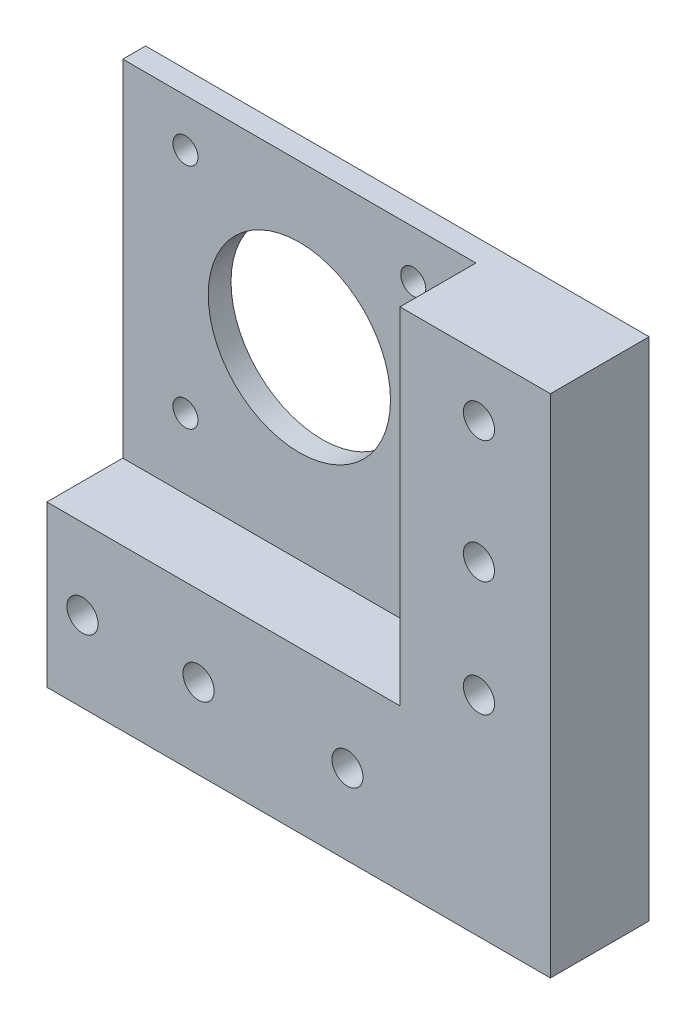
from build123d import *

# Parameters (mm, degrees)
SKETCH1_W                = 46.5
SKETCH1_H                = 40
BOSS_EXTRUDE1_DEPTH      = 3
BOSS_EXTRUDE2_DEPTH      = 42.5
SKETCH4_R                = 12
SKETCH4_R_2              = 1.65
CUT_EXTRUDE2_DEPTH       = 77.37080594
SKETCH7_W                = 19.811299136
SKETCH7_H                = 45.5
SKETCH7_R                = 2.05
SKETCH7_W_2              = 46.5
SKETCH7_H_2              = 21.133566933
SKETCH7_R_2              = 1.65
SKETCH7_R_3              = 12
BOSS_EXTRUDE3_DEPTH      = 3
BOSS_EXTRUDE8_DEPTH      = 10
BOSS_EXTRUDE8_DEPTH_BACK = 3
SKETCH7_6_W              = 19.811299136
SKETCH7_6_H              = 21.133566933
SKETCH7_6_H_2            = 45.5
SKETCH7_6_R              = 2.05
SKETCH7_6_W_2            = 46.5
CUT_EXTRUDE4_DEPTH       = 37


with BuildPart() as part:
    # Sketch1 → Boss-Extrude1 (new body)
    with BuildSketch(Plane(origin=(0, 0, 0), x_dir=(1, 0, 0), z_dir=(0, 1, 0))):
        with Locations((23.25, 20)):
            Rectangle(SKETCH1_W, SKETCH1_H)
    extrude(amount=BOSS_EXTRUDE1_DEPTH)

    # Sketch2 → Boss-Extrude2 (add)
    with BuildSketch(Plane(origin=(0, 3, 0), x_dir=(1, 0, 0), z_dir=(0, 1, 0))):
        Polygon((2, 2.5), (2, 40), (0, 40), (0, 0), (46.5, 0), (46.5, 40), (44.5, 40), (44.5, 2.5), align=None)
    extrude(amount=BOSS_EXTRUDE2_DEPTH)

    # Sketch4 → Cut-Extrude2 (cut, through all)
    with BuildSketch(Plane.XY):
        with Locations((23.25, 24.25)):
            Circle(SKETCH4_R)
        with Locations((8.25, 9.25)):
            Circle(SKETCH4_R_2)
        with Locations((8.25, 39.25)):
            Circle(SKETCH4_R_2)
        with Locations((38.25, 39.25)):
            Circle(SKETCH4_R_2)
        with Locations((38.25, 9.25)):
            Circle(SKETCH4_R_2)
    extrude(amount=-CUT_EXTRUDE2_DEPTH, mode=Mode.SUBTRACT)

    # Sketch7 → Boss-Extrude3 (add)
    # profile 1 of 3: a face of its own
    with BuildSketch(Plane.XY):
        with Locations((56.405649568, 22.75)):
            Rectangle(SKETCH7_W, SKETCH7_H)
        with Locations((56.903073356, 21.609445831)):
            Circle(SKETCH7_R, mode=Mode.SUBTRACT)
        with Locations((56.903073356, 6.429697542)):
            Circle(SKETCH7_R, mode=Mode.SUBTRACT)
        with Locations((56.903073356, 37.721588907)):
            Circle(SKETCH7_R, mode=Mode.SUBTRACT)
    # profile 2 of 3: a face of its own
    with BuildSketch(Plane.XY):
        with Locations((23.25, -10.566783467)):
            Rectangle(SKETCH7_W_2, SKETCH7_H_2)
        with Locations((19.976924994, -10.566783466)):
            Circle(SKETCH7_R, mode=Mode.SUBTRACT)
        with Locations((4.691261717, -10.566783466)):
            Circle(SKETCH7_R, mode=Mode.SUBTRACT)
        with Locations((39.582435854, -10.566783466)):
            Circle(SKETCH7_R, mode=Mode.SUBTRACT)
    # profile 3 of 3: a face of its own
    with BuildSketch(Plane.XY):
        with Locations((23.25, 22.75)):
            Rectangle(SKETCH7_W_2, SKETCH7_H)
        with Locations((8.25, 39.25)):
            Circle(SKETCH7_R_2, mode=Mode.SUBTRACT)
        with Locations((38.25, 9.25)):
            Circle(SKETCH7_R_2, mode=Mode.SUBTRACT)
        with Locations((23.25, 24.25)):
            Circle(SKETCH7_R_3, mode=Mode.SUBTRACT)
        with Locations((38.25, 39.25)):
            Circle(SKETCH7_R_2, mode=Mode.SUBTRACT)
        with Locations((8.25, 9.25)):
            Circle(SKETCH7_R_2, mode=Mode.SUBTRACT)
    extrude(amount=-BOSS_EXTRUDE3_DEPTH)

    # Sketch7<6> → Boss-Extrude8 (add, two sides: drawn at the far end of the back side and taken through both)
    # profile 1 of 3: a face of its own
    with BuildSketch(Plane.XY.offset(-BOSS_EXTRUDE8_DEPTH_BACK)):
        with Locations((56.405649568, -10.566783467)):
            Rectangle(SKETCH7_6_W, SKETCH7_6_H)
    # profile 2 of 3: a face of its own
    with BuildSketch(Plane.XY.offset(-BOSS_EXTRUDE8_DEPTH_BACK)):
        with Locations((56.405649568, 22.75)):
            Rectangle(SKETCH7_6_W, SKETCH7_6_H_2)
        with Locations((56.903073356, 21.609445831)):
            Circle(SKETCH7_6_R, mode=Mode.SUBTRACT)
        with Locations((56.903073356, 6.429697542)):
            Circle(SKETCH7_6_R, mode=Mode.SUBTRACT)
        with Locations((56.903073356, 37.721588907)):
            Circle(SKETCH7_6_R, mode=Mode.SUBTRACT)
    # profile 3 of 3: a face of its own
    with BuildSketch(Plane.XY.offset(-BOSS_EXTRUDE8_DEPTH_BACK)):
        with Locations((23.25, -10.566783467)):
            Rectangle(SKETCH7_6_W_2, SKETCH7_6_H)
        with Locations((19.976924994, -10.566783466)):
            Circle(SKETCH7_6_R, mode=Mode.SUBTRACT)
        with Locations((4.691261717, -10.566783466)):
            Circle(SKETCH7_6_R, mode=Mode.SUBTRACT)
        with Locations((39.582435854, -10.566783466)):
            Circle(SKETCH7_6_R, mode=Mode.SUBTRACT)
    extrude(amount=BOSS_EXTRUDE8_DEPTH + BOSS_EXTRUDE8_DEPTH_BACK)

    # Sketch8 → Cut-Extrude4 (cut)
    with BuildSketch(Plane(origin=(0, 0, -3), x_dir=(-1, 0, 0), z_dir=(0, 0, -1))):
        Polygon((-44.5, 45.5), (-44.5, 3), (-2, 3), (-2, 45.5), (0, 45.5), (0, 0), (-46.5, 0), (-46.5, 45.5), align=None)
    extrude(amount=CUT_EXTRUDE4_DEPTH, mode=Mode.SUBTRACT)


solid = part.part
